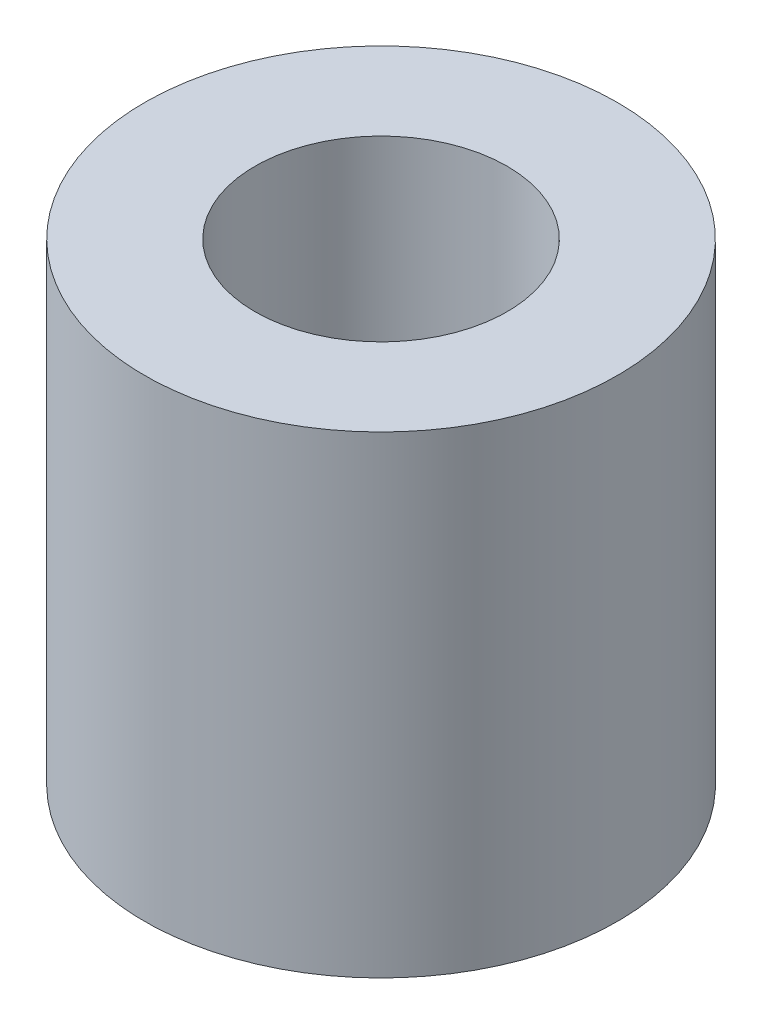
from build123d import *

# Parameters (mm, degrees)
SKETCH1_R           = 4.7625
SKETCH1_R_2         = 2.54
BOSS_EXTRUDE1_DEPTH = 9.525


with BuildPart() as part:
    # Sketch1 → Boss-Extrude1 (new body)
    with BuildSketch(Plane(origin=(0, 0, 0), x_dir=(1, 0, 0), z_dir=(0, 1, 0))):
        with Locations(Location((0, 0, 0), (0, 0, 90))):
            Circle(SKETCH1_R)
        with Locations(Location((0, 0, 0), (0, 0, 90))):
            Circle(SKETCH1_R_2, mode=Mode.SUBTRACT)
    extrude(amount=BOSS_EXTRUDE1_DEPTH)


solid = part.part
